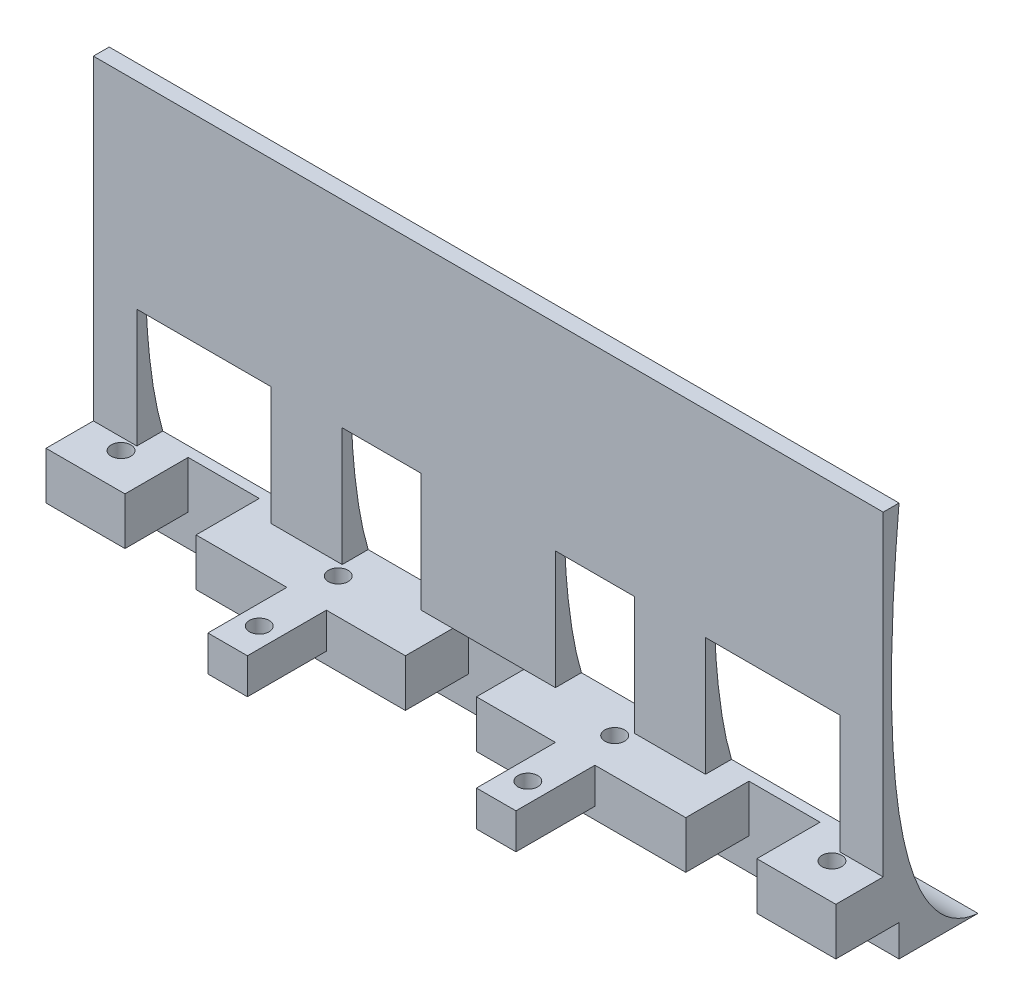
from build123d import *

# Parameters (mm, degrees)
SZKIC1_W                         = 100
SZKIC1_H                         = 28
OGOLNY_KSZTALT_DEPTH             = 50
ZAKRZYWUIENIE_OUTSIDE_W          = 53.052
ZAKRZYWUIENIE_OUTSIDE_H          = 75.052
WYCIECIE_KSZTAL_PRZOD_DEPTH      = 105
WYCIECIE_KSZTALTU_TYL_DEPTH      = 23
WYCIECIE_KSZTALTU_TYL_DEPTH_BACK = 99.5
SZKIC4_W                         = 30.5
SZKIC4_H                         = 10
SZKIC5_W                         = 39
SZKIC5_H                         = 10
PODBICIE_TYL_SPOD_DEPTH          = 5.5
SZKIC6_W                         = 100
SZKIC6_H                         = 8
PODBICIE_SRODEK_SPOD_DEPTH       = 4
PRZYCIECIE_OD_GORY_DEPTH         = 40
OTWORY_NA_SRUBY_DEPTH            = 90
OTWORY_NA_SRUBY_DEPTH_BACK       = 71
SZKIC8_R                         = 1.25
SZKIC9_W                         = 9
SZKIC9_H                         = 10
KTIR_KABLE_DEPTH                 = 10
WYTNIJ_WYCI_GNI_CIE3_DEPTH       = 84
WYTNIJ_WYCI_GNI_CIE3_DEPTH_BACK  = 81
SZKIC10_W                        = 29
SZKIC10_H                        = 10
WYTNIJ_WYCI_GNI_CIE4_DEPTH       = 59
WYTNIJ_WYCI_GNI_CIE4_DEPTH_BACK  = 55
SZKIC11_W                        = 10
SZKIC11_H                        = 15
SZKIC11_W_2                      = 17


with BuildPart() as part:
    # Szkic1 → ogolny ksztalt (new body)
    with BuildSketch(Plane(origin=(0, 0, 0), x_dir=(1, 0, 0), z_dir=(0, 1, 0))):
        with Locations((-50, 14)):
            Rectangle(SZKIC1_W, SZKIC1_H)
    extrude(amount=OGOLNY_KSZTALT_DEPTH)

    # zakrzywuienie outside → wyciecie ksztal przod (cut)
    with BuildSketch(Plane(origin=(0, 0, 0), x_dir=(0, 0, -1), z_dir=(1, 0, 0))):
        with Locations((14, 25)):
            Rectangle(ZAKRZYWUIENIE_OUTSIDE_W, ZAKRZYWUIENIE_OUTSIDE_H)
        with BuildLine():
            Line((28, 0), (18, 0))
            Line((18, 0), (0, 0))
            Line((0, 0), (0, 50))
            Line((0, 50), (18, 50))
            add(Edge.make_bspline(
                [(18, 50), (14.693585387, 12.992576306), (20.397077092, 0.692779903), (28, 0)],
                knots=[0, 0, 0, 0, 1, 1, 1, 1], degree=3))
        make_face(mode=Mode.SUBTRACT)
    extrude(amount=-WYCIECIE_KSZTAL_PRZOD_DEPTH, mode=Mode.SUBTRACT)

    # Szkic4 → wyciecie ksztaltu tyl (cut, two sides: drawn at the far end of the back side and taken through both)
    with BuildSketch(Plane(origin=(0, 0, 0), x_dir=(-1, 0, 0), z_dir=(0, -1, 0)).offset(-WYCIECIE_KSZTALTU_TYL_DEPTH_BACK)):
        with Locations((84.75, 5)):
            Rectangle(SZKIC4_W, SZKIC4_H)
        with Locations((15.25, 5)):
            Rectangle(SZKIC4_W, SZKIC4_H)
    extrude(amount=WYCIECIE_KSZTALTU_TYL_DEPTH + WYCIECIE_KSZTALTU_TYL_DEPTH_BACK, mode=Mode.SUBTRACT)

    # Szkic5 → podbicie tyl(spod) (cut)
    with BuildSketch(Plane(origin=(0, 0, 0), x_dir=(-1, 0, 0), z_dir=(0, -1, 0))):
        with Locations((50, 5)):
            Rectangle(SZKIC5_W, SZKIC5_H)
    extrude(amount=-PODBICIE_TYL_SPOD_DEPTH, mode=Mode.SUBTRACT)

    # Szkic6 → podbicie srodek(spod) (cut)
    with BuildSketch(Plane(origin=(0, 0, 0), x_dir=(-1, 0, 0), z_dir=(0, -1, 0))):
        with Locations((50, 14)):
            Rectangle(SZKIC6_W, SZKIC6_H)
    extrude(amount=-PODBICIE_SRODEK_SPOD_DEPTH, mode=Mode.SUBTRACT)

    # Szkic7 → przyciecie od gory (cut)
    with BuildSketch(Plane(origin=(0, 50, 0), x_dir=(1, 0, 0), z_dir=(0, 1, 0))):
        Polygon((0, 10), (-30.5, 10), (-30.5, 0), (-69.5, 0), (-69.5, 10), (-100, 10), (-100, 16), (0, 16), align=None)
    extrude(amount=-PRZYCIECIE_OD_GORY_DEPTH, mode=Mode.SUBTRACT)

    # Szkic8 → otwory na sruby (cut, two sides: drawn at the far end of the back side and taken through both)
    with BuildSketch(Plane(origin=(0, 5.5, 0), x_dir=(-1, 0, 0), z_dir=(0, -1, 0)).offset(-OTWORY_NA_SRUBY_DEPTH_BACK)):
        with Locations(Location((67, 4, 0), (0, 0, 270))):
            Circle(SZKIC8_R)
        with Locations(Location((33, 4, 0), (0, 0, 270))):
            Circle(SZKIC8_R)
        with Locations(Location((67.5, 14.5, 0), (0, 0, 270))):
            Circle(SZKIC8_R)
        with Locations(Location((32.5, 14.5, 0), (0, 0, 270))):
            Circle(SZKIC8_R)
        with Locations(Location((95, 14.5, 0), (0, 0, 270))):
            Circle(SZKIC8_R)
        with Locations(Location((5, 14.5, 0), (0, 0, 270))):
            Circle(SZKIC8_R)
    extrude(amount=OTWORY_NA_SRUBY_DEPTH + OTWORY_NA_SRUBY_DEPTH_BACK, mode=Mode.SUBTRACT)

    # Szkic9 → ktir kable (cut)
    with BuildSketch(Plane(origin=(0, 0, 0), x_dir=(-1, 0, 0), z_dir=(0, -1, 0))):
        with Locations((50, 13)):
            Rectangle(SZKIC9_W, SZKIC9_H)
        with Locations((14.5, 13)):
            Rectangle(SZKIC9_W, SZKIC9_H)
        with Locations((85.5, 13)):
            Rectangle(SZKIC9_W, SZKIC9_H)
    extrude(amount=-KTIR_KABLE_DEPTH, mode=Mode.SUBTRACT)

    # Szkic10 → Wytnij-wyciągnięcie3 (cut, two sides: drawn at the far end of the back side and taken through both)
    with BuildSketch(Plane.XZ.offset(-5.5).offset(-WYTNIJ_WYCI_GNI_CIE3_DEPTH_BACK)):
        with Locations((-50, -5)):
            Rectangle(SZKIC10_W, SZKIC10_H)
    extrude(amount=WYTNIJ_WYCI_GNI_CIE3_DEPTH + WYTNIJ_WYCI_GNI_CIE3_DEPTH_BACK, mode=Mode.SUBTRACT)

    # Szkic11 → Wytnij-wyciągnięcie4 (cut, two sides: drawn at the far end of the back side and taken through both)
    with BuildSketch(Plane.XY.offset(-16).offset(-WYTNIJ_WYCI_GNI_CIE4_DEPTH_BACK)):
        with Locations((-63.5, 17.5)):
            Rectangle(SZKIC11_W, SZKIC11_H)
        with Locations((-36.5, 17.5)):
            Rectangle(SZKIC11_W, SZKIC11_H)
        with Locations((-86, 17.5)):
            Rectangle(SZKIC11_W_2, SZKIC11_H)
        with Locations((-14, 17.5)):
            Rectangle(SZKIC11_W_2, SZKIC11_H)
    extrude(amount=WYTNIJ_WYCI_GNI_CIE4_DEPTH + WYTNIJ_WYCI_GNI_CIE4_DEPTH_BACK, mode=Mode.SUBTRACT)


solid = part.part
